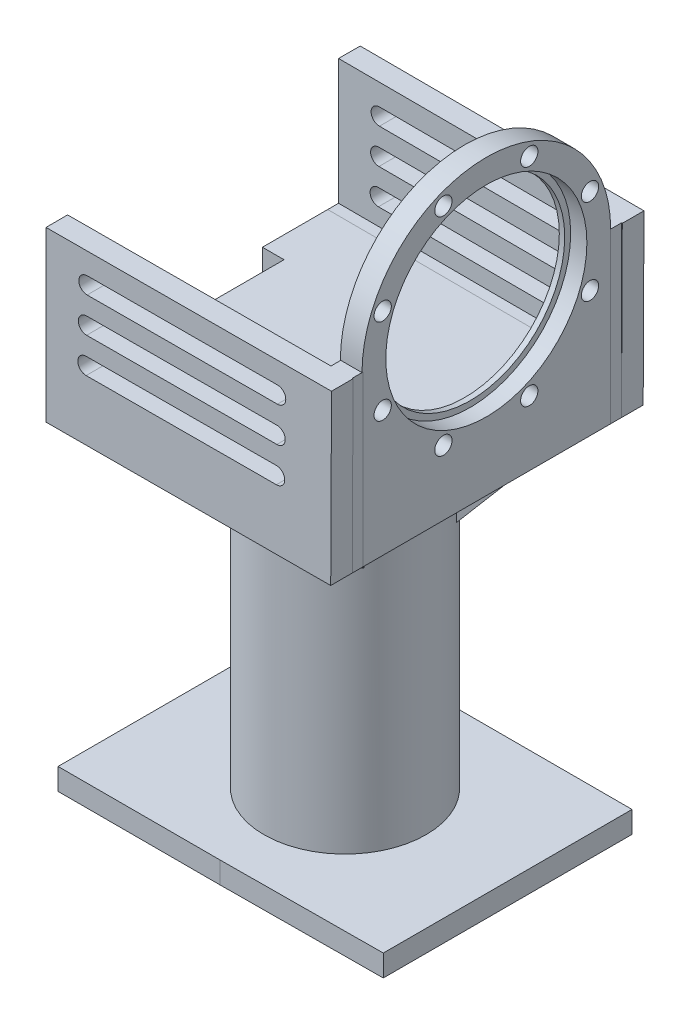
from build123d import *

# Parameters (mm, degrees)
SKETCH_1_R                = 1.6
SKETCH_1_R_2              = 18.6
EXTRUDE_1_DEPTH           = 4
EXTRUDE_2_DEPTH           = 1
EXTRUDE_3_DEPTH           = 8
SKETCH_3_R                = 1.85
CUT_EXTRUDE_1_DEPTH       = 5
CHAMFER_2_SIZE            = 0.4
EXTRUDE_7_DEPTH           = 2
EXTRUDE_8_DEPTH           = 4
SKETCH_6_R                = 15
SKETCH_6_R_2              = 10
EXTRUDE_9_DEPTH           = 60
RIB_24_REACH              = 108.905
SKETCH_12_WALL_W          = 236.72683344
SKETCH_12_WALL_H          = 5
PATTERN_CIRCULAR_13_COUNT = 2
RIB_25_REACH              = 108.475
SKETCH_13_WALL_W          = 234.85356175
SKETCH_13_WALL_H          = 5
PATTERN_CIRCULAR_14_COUNT = 2
EXTRUDE_10_DEPTH          = 4


with BuildPart() as part:
    # 草图1 → 凸台-拉伸1 (new body)
    with BuildSketch(Plane(origin=(0, 0, 0), x_dir=(0, 0, -1), z_dir=(1, 0, 0))):
        with BuildLine():
            ThreePointArc((23, 0), (0, 23), (-23, 0))
            Line((-23, 0), (-23, -23.2))
            Line((-23, -23.2), (23, -23.2))
            Line((23, -23.2), (23, 0))
        make_face()
        with Locations((-7.942246996, -19.174280415)):
            Circle(SKETCH_1_R, mode=Mode.SUBTRACT)
        with Locations((-19.174280415, -7.942246996)):
            Circle(SKETCH_1_R, mode=Mode.SUBTRACT)
        with Locations((7.942246996, -19.174280415)):
            Circle(SKETCH_1_R, mode=Mode.SUBTRACT)
        with Locations((19.174280415, -7.942246996)):
            Circle(SKETCH_1_R, mode=Mode.SUBTRACT)
        with Locations((-19.174280415, 7.942246996)):
            Circle(SKETCH_1_R, mode=Mode.SUBTRACT)
        with Locations((-7.942246996, 19.174280415)):
            Circle(SKETCH_1_R, mode=Mode.SUBTRACT)
        Circle(SKETCH_1_R_2, mode=Mode.SUBTRACT)
        with Locations((19.174280415, 7.942246996)):
            Circle(SKETCH_1_R, mode=Mode.SUBTRACT)
        with Locations((7.942246996, 19.174280415)):
            Circle(SKETCH_1_R, mode=Mode.SUBTRACT)
    extrude(amount=EXTRUDE_1_DEPTH)

    # 草图1<3> → 凸台-拉伸2 (add)
    with BuildSketch(Plane(origin=(0, 0, 0), x_dir=(0, 0, -1), z_dir=(1, 0, 0))):
        with BuildLine():
            ThreePointArc((18.6, 0), (0, 18.6), (-18.6, 0))
            ThreePointArc((-18.6, 0), (0, -18.6), (18.6, 0))
        make_face()
        with BuildLine():
            ThreePointArc((17.5, 0), (0, -17.5), (-17.5, 0))
            ThreePointArc((-17.5, 0), (0, 17.5), (17.5, 0))
        make_face(mode=Mode.SUBTRACT)
    extrude(amount=EXTRUDE_2_DEPTH)

    # 草图2 → 凸台-拉伸3 (add)
    with BuildSketch(Plane.XZ.offset(23.2)):
        Polygon((4, -23), (4, 23), (-48.499757106, 23), (-48.499757106, 10.920150371), (-44.499757106, 10.920150371), (-44.499757106, -11.079849629), (-48.499757106, -11.079849629), (-48.499757106, -23.159699257), align=None)
    extrude(amount=EXTRUDE_3_DEPTH)

    # 草图3 → 切除-拉伸1 (cut)
    with BuildSketch(Plane.ZY.offset(44.499757106)):
        with Locations((5.920150371, -27.2)):
            Circle(SKETCH_3_R)
        with Locations((-6.079849629, -27.2)):
            Circle(SKETCH_3_R)
    extrude(amount=-CUT_EXTRUDE_1_DEPTH, mode=Mode.SUBTRACT)

    # 倒角2
    chamfer_2_edges = [part.edges().sort_by_distance(p)[0] for p in [
        (-44.499757106, -27.2, 4.070150371),
        (-44.499757106, -27.2, -7.929849629),
    ]]
    chamfer(chamfer_2_edges, length=CHAMFER_2_SIZE)

    # 草图6 → 凸台-拉伸9 (add)
    with BuildSketch(Plane.XZ.offset(31.2)):
        with Locations((-22.23771099, -0.1)):
            Circle(SKETCH_6_R)
        with Locations((-22.23771099, -0.1)):
            Circle(SKETCH_6_R_2, mode=Mode.SUBTRACT)
    extrude(amount=EXTRUDE_9_DEPTH)

    # 草图12 wall → 筋24 (add, up to next)
    with BuildSketch(Plane(origin=(-5.361401372, -38.595476089, -14.822347737), x_dir=(0.532846585871, 0.707106781177, -0.464838161019), z_dir=(-0.532846585853, 0.707106781196, 0.46483816101)), mode=Mode.PRIVATE) as rib_24_sk1:
        Rectangle(SKETCH_12_WALL_W, SKETCH_12_WALL_H)
    rib_24_tool1 = extrude(rib_24_sk1.sketch, amount=RIB_24_REACH, mode=Mode.PRIVATE) - part.part
    rib_24 = rib_24_tool1.solids().sort_by_distance((-5.361401372, -38.595476089, -14.822347737))[0]
    add(rib_24)

    # 阵列(圆周)13: 筋24 ×2 about axis
    pattern_circular_13_axis = Axis((-22.23771099, -91.2, -0.1), (0, 1, 0))
    for i in range(1, PATTERN_CIRCULAR_13_COUNT):
        add(rib_24.rotate(pattern_circular_13_axis, i * 360 / PATTERN_CIRCULAR_13_COUNT))

    # 草图13 wall → 筋25 (add, up to next)
    with BuildSketch(Plane(origin=(-6.655035456, -38.237231079, 15.482675535), x_dir=(0.500000000026, 0.707106781186, 0.499999999976), z_dir=(-0.499999999999, 0.707106781187, -0.499999999999)), mode=Mode.PRIVATE) as rib_25_sk1:
        Rectangle(SKETCH_13_WALL_W, SKETCH_13_WALL_H)
    rib_25_tool1 = extrude(rib_25_sk1.sketch, amount=RIB_25_REACH, mode=Mode.PRIVATE) - part.part
    rib_25 = rib_25_tool1.solids().sort_by_distance((-6.655035456, -38.237231079, 15.482675535))[0]
    add(rib_25)

    # 阵列(圆周)14: 筋25 ×2 about axis
    pattern_circular_14_axis = Axis((-22.23771099, -91.2, -0.1), (0, 1, 0))
    for i in range(1, PATTERN_CIRCULAR_14_COUNT):
        add(rib_25.rotate(pattern_circular_14_axis, i * 360 / PATTERN_CIRCULAR_14_COUNT))

    # 草图16 → 凸台-拉伸10 (add)
    with BuildSketch(Plane.XZ.offset(91.2)):
        Polygon((-22.249878553, 23), (7.749520178, 22.810063751), (7.749520178, -23.2), (-22.225543428, -23.2), (-52.225543428, -23.2), (-52.225543428, 23), align=None)
    extrude(amount=EXTRUDE_10_DEPTH)


with BuildPart() as body_2:
    # 草图4 → 凸台-拉伸7 (new, along a direction that is not the sketch's normal)
    with BuildSketch(Plane(origin=(0.070000173, 0, -23.011954685), x_dir=(-0.9999953734400472, 0, -0.003041890612873783), z_dir=(0.003041890612873783, 0, -0.9999953734400472))):
        Polygon((-3.93001801, 0), (0, 0), (0, -23.2), (48.56998199, -23.2), (48.56998199, -31.2), (-3.93001801, -31.2), align=None)
    extrude(amount=EXTRUDE_7_DEPTH, dir=(0, 0, -1))

    # 草图5 → 凸台-拉伸8 (add)
    with BuildSketch(Plane(origin=(0.076083926, 0, -25.011936179), x_dir=(-0.9999953734400472, 0, -0.0030418906128740326), z_dir=(0.0030418906128740326, 0, -0.9999953734400472))):
        Polygon((-4.069944978, 0), (-3.923934228, -31.2), (48.576065772, -31.2), (48.576065772, 0), align=None)
        with BuildLine():
            Line((5.907026727, -3.964013685), (40.991495952, -3.964013685))
            ThreePointArc((40.991495952, -3.964013685), (42.532674187, -5.50519192), (40.991495952, -7.046370155))
            Line((40.991495952, -7.046370155), (5.907026727, -7.046370155))
            ThreePointArc((5.907026727, -7.046370155), (4.365848493, -5.50519192), (5.907026727, -3.964013685))
        make_face(mode=Mode.SUBTRACT)
        with BuildLine():
            Line((6.000496452, -10.463341605), (41.084965677, -10.463341605))
            ThreePointArc((41.084965677, -10.463341605), (42.626143912, -12.00451984), (41.084965677, -13.545698074))
            Line((41.084965677, -13.545698074), (6.000496452, -13.545698074))
            ThreePointArc((6.000496452, -13.545698074), (4.459318217, -12.00451984), (6.000496452, -10.463341605))
        make_face(mode=Mode.SUBTRACT)
        with BuildLine():
            Line((6.093966177, -16.962669525), (41.178435402, -16.962669525))
            ThreePointArc((41.178435402, -16.962669525), (42.719613636, -18.50384776), (41.178435402, -20.045025994))
            Line((41.178435402, -20.045025994), (6.093966177, -20.045025994))
            ThreePointArc((6.093966177, -20.045025994), (4.552787942, -18.50384776), (6.093966177, -16.962669525))
        make_face(mode=Mode.SUBTRACT)
    extrude(amount=EXTRUDE_8_DEPTH)


with BuildPart() as body_3:
    # 镜向3: mirrored copy
    add(body_2.part.mirror(Plane.XY))


with BuildPart() as body_3_1:
    # Move Body 1: moved
    add(body_3.part.moved(Location((0, 0, -0.2))))


solid = Compound([part.part, body_2.part, body_3_1.part])
